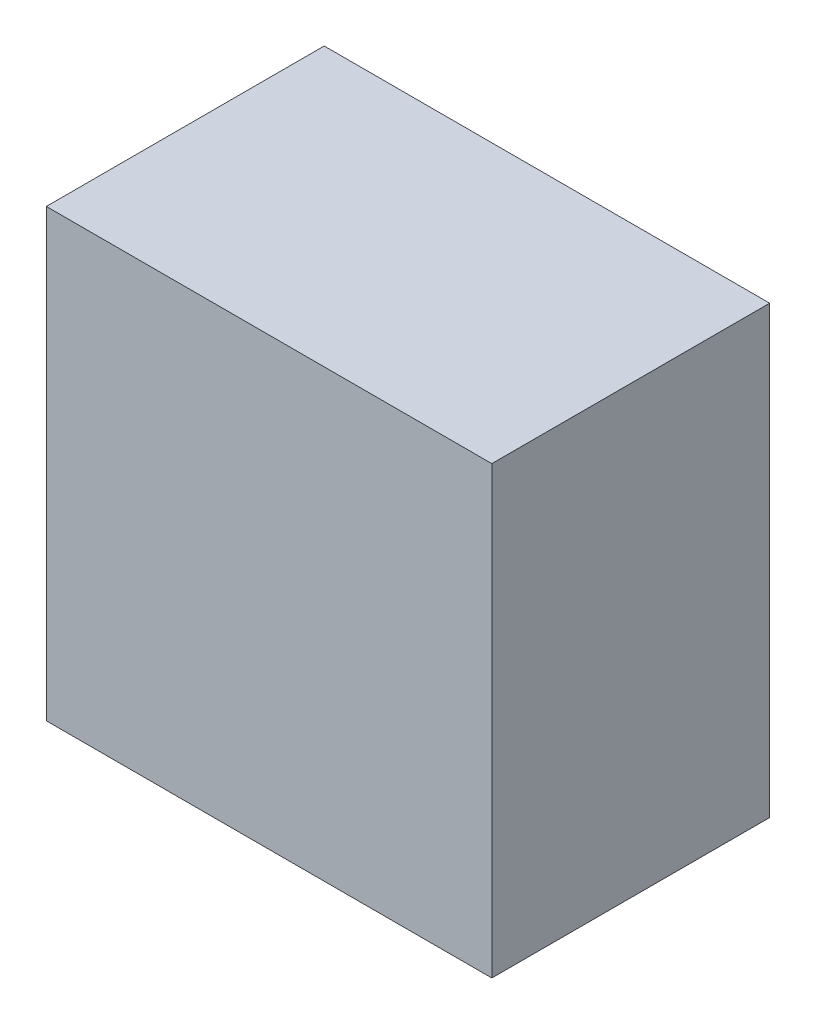
from build123d import *

# Parameters (mm, degrees)
SKETCH1_W               = 1.6032
SKETCH1_H               = 1.6032
COMPONENT_OUTLINE_DEPTH = 1


with BuildPart() as part:
    # Sketch1 → Component_Outline (new body)
    with BuildSketch(Plane.XY):
        Rectangle(SKETCH1_W, SKETCH1_H)
    extrude(amount=COMPONENT_OUTLINE_DEPTH)


solid = part.part
